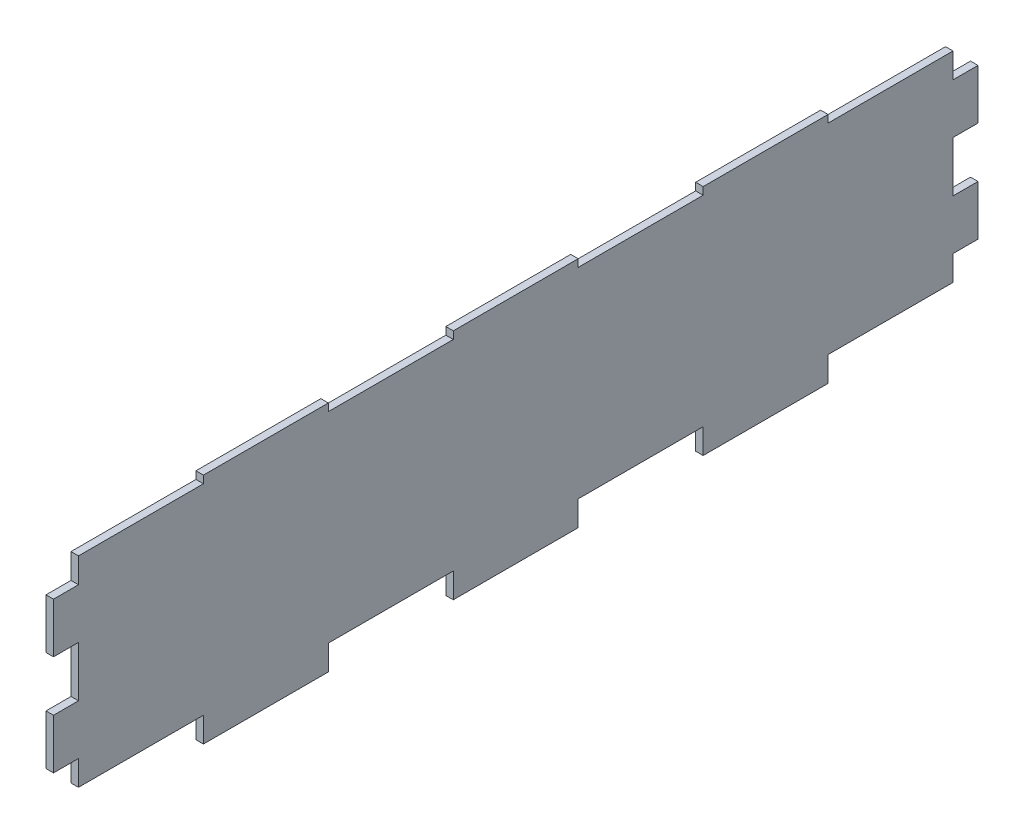
from build123d import *

# Parameters (mm, degrees)
EXTRUDE_1_DEPTH = 3


with BuildPart() as part:
    # 스케치1 → 보스-돌출1 (new body)
    with BuildSketch(Plane(origin=(0, 0, 0), x_dir=(0, 0, -1), z_dir=(1, 0, 0))):
        Polygon((125, 36.883265306), (75, 36.883265306), (75, 33.883265306), (25, 33.883265306), (25, 36.883265306), (-25, 36.883265306), (-25, 33.883265306), (-75, 33.883265306), (-75, 36.883265306), (-125, 36.883265306), (-125, 33.883265306), (-175, 33.883265306), (-175, 23.883265306), (-185, 23.883265306), (-185, 3.883265306), (-175, 3.883265306), (-175, -16.346734694), (-185, -16.346734694), (-185, -36.346734694), (-175, -36.346734694), (-175, -46.346734694), (-125, -46.346734694), (-125, -56.346734694), (-75, -56.346734694), (-75, -46.346734694), (-25, -46.346734694), (-25, -56.346734694), (25, -56.346734694), (25, -46.346734694), (75, -46.346734694), (75, -56.346734694), (125, -56.346734694), (125, -46.346734694), (175, -46.346734694), (175, -36.346734694), (185, -36.346734694), (185, -16.346734694), (175, -16.346734694), (175, 3.883265306), (185, 3.883265306), (185, 23.883265306), (175, 23.883265306), (175, 33.883265306), (125, 33.883265306), align=None)
    extrude(amount=EXTRUDE_1_DEPTH)


solid = part.part
